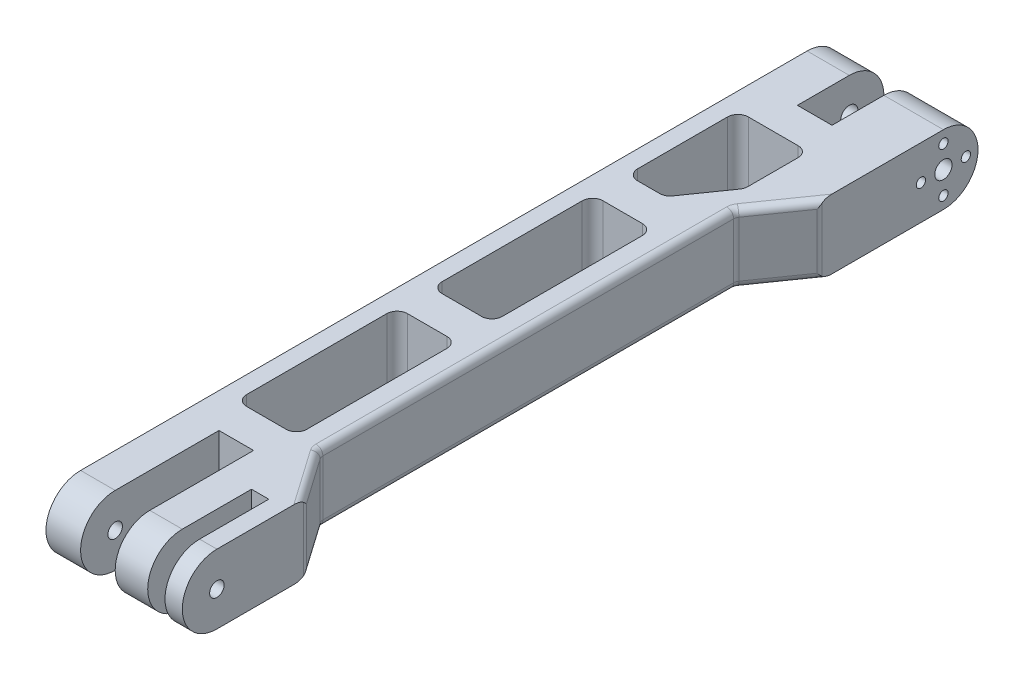
from build123d import *

# Parameters (mm, degrees)
SKETCH_1_W          = 39.4
SKETCH_1_H          = 20
EXTRUDE_1_DEPTH     = 230
FILLET_2_RADIUS     = 10
FILLET_2_LENGTH     = 39.4
SKETCH_2_R          = 2.5
CUT_EXTRUDE_1_DEPTH = 235.205806931
SKETCH_3_W          = 10
SKETCH_3_H          = 25
CUT_EXTRUDE_2_DEPTH = 235.205806931
SKETCH_4_R          = 1.35
CUT_EXTRUDE_3_DEPTH = 20
CUT_EXTRUDE_4_DEPTH = 235.205806931
FILLET_4_R          = 2
FILLET_5_RADIUS     = 10
FILLET_5_LENGTH     = 39.4
SKETCH_6_R          = 2.1
CUT_EXTRUDE_5_DEPTH = 235.205806931
SKETCH_7_W          = 10
SKETCH_7_H          = 40
CUT_EXTRUDE_6_DEPTH = 235.205806931
CUT_EXTRUDE_7_DEPTH = 235.205806931
SKETCH_9_W          = 5
SKETCH_9_H          = 30
CUT_EXTRUDE_8_DEPTH = 235.205806931


with BuildPart() as part:
    # 草图1 → 凸台-拉伸1 (new body)
    with BuildSketch(Plane.XY):
        with Locations((19.7, 10)):
            Rectangle(SKETCH_1_W, SKETCH_1_H)
    extrude(amount=EXTRUDE_1_DEPTH)

    # 圆角2: full round fillet: the end face becomes a half cylinder, R = half its width
    fillet_2_face = Plane((19.7, 10, 0), x_dir=(1, 0, 0), z_dir=(0, 0, -1))  # on the end face: x along it, z out of the body
    fillet_2_slab = fillet_2_face.offset(-FILLET_2_RADIUS / 2) * Box(FILLET_2_LENGTH, 2 * FILLET_2_RADIUS, FILLET_2_RADIUS, mode=Mode.PRIVATE)  # the body's end, R deep
    fillet_2_round = Plane((19.7, 10, 10), x_dir=(0, 0, -1), z_dir=(1, 0, 0)) * Cylinder(FILLET_2_RADIUS, FILLET_2_LENGTH, mode=Mode.PRIVATE)  # its axis R under the face
    add(fillet_2_slab - fillet_2_round, mode=Mode.SUBTRACT)

    # 草图2 → 切除-拉伸1 (cut, through all)
    with BuildSketch(Plane.ZY):
        with Locations((10, 10)):
            Circle(SKETCH_2_R)
    extrude(amount=-CUT_EXTRUDE_1_DEPTH, mode=Mode.SUBTRACT)

    # 草图3 → 切除-拉伸2 (cut, through all)
    with BuildSketch(Plane(origin=(0, 0, 0), x_dir=(-1, 0, 0), z_dir=(0, -1, 0))):
        with Locations((-17.2, -12.5)):
            Rectangle(SKETCH_3_W, SKETCH_3_H)
    extrude(amount=-CUT_EXTRUDE_2_DEPTH, mode=Mode.SUBTRACT)

    # 草图4 → 切除-拉伸3 (cut)
    with BuildSketch(Plane(origin=(39.4, 0, 0), x_dir=(0, 0, -1), z_dir=(1, 0, 0))):
        with Locations((-3.5, 10)):
            Circle(SKETCH_4_R)
        with Locations((-10, 16.5)):
            Circle(SKETCH_4_R)
        with Locations((-16.5, 10)):
            Circle(SKETCH_4_R)
        with Locations((-10, 3.5)):
            Circle(SKETCH_4_R)
    extrude(amount=-CUT_EXTRUDE_3_DEPTH, mode=Mode.SUBTRACT)

    # 草图5 → 切除-拉伸4 (cut, through all)
    with BuildSketch(Plane(origin=(0, 0, 0), x_dir=(-1, 0, 0), z_dir=(0, -1, 0))):
        Polygon((-39.4, -45.718519933), (-29.4, -60), (-29.4, -180), (-39.4, -194.281480067), align=None)
    extrude(amount=-CUT_EXTRUDE_4_DEPTH, mode=Mode.SUBTRACT)

    # 圆角4
    fillet_4_edges = [part.edges().sort_by_distance(p)[0] for p in [
        (39.4, 10, 194.281480067),
        (34.4, 20, 52.859259966),
        (39.4, 10, 45.718519933),
        (29.4, 20, 120),
        (29.4, 10, 60),
        (34.4, 20, 187.140740034),
        (29.4, 10, 180),
        (34.4, 0, 187.140740034),
        (29.4, 0, 120),
        (34.4, 0, 52.859259966),
    ]]
    fillet(fillet_4_edges, radius=FILLET_4_R)

    # 圆角5: full round fillet: the end face becomes a half cylinder, R = half its width
    fillet_5_face = Plane((19.7, 10, 230), x_dir=(-1, 0, 0), z_dir=(0, 0, 1))  # on the end face: x along it, z out of the body
    fillet_5_slab = fillet_5_face.offset(-FILLET_5_RADIUS / 2) * Box(FILLET_5_LENGTH, 2 * FILLET_5_RADIUS, FILLET_5_RADIUS, mode=Mode.PRIVATE)  # the body's end, R deep
    fillet_5_round = Plane((19.7, 10, 220), x_dir=(0, 0, 1), z_dir=(-1, 0, 0)) * Cylinder(FILLET_5_RADIUS, FILLET_5_LENGTH, mode=Mode.PRIVATE)  # its axis R under the face
    add(fillet_5_slab - fillet_5_round, mode=Mode.SUBTRACT)

    # 草图6 → 切除-拉伸5 (cut, through all)
    with BuildSketch(Plane.ZY):
        with Locations((220, 10)):
            Circle(SKETCH_6_R)
    extrude(amount=-CUT_EXTRUDE_5_DEPTH, mode=Mode.SUBTRACT)

    # 草图7 → 切除-拉伸6 (cut, through all)
    with BuildSketch(Plane(origin=(0, 0, 0), x_dir=(-1, 0, 0), z_dir=(0, -1, 0))):
        with Locations((-15, -210)):
            Rectangle(SKETCH_7_W, SKETCH_7_H)
    extrude(amount=-CUT_EXTRUDE_6_DEPTH, mode=Mode.SUBTRACT)

    # 草图8 → 切除-拉伸7 (cut, through all)
    with BuildSketch(Plane(origin=(0, 0, 0), x_dir=(-1, 0, 0), z_dir=(0, -1, 0))):
        with BuildLine():
            Line((-5, -64), (-5, -38))
            ThreePointArc((-5, -38), (-5.878679656, -35.878679656), (-8, -35))
            Line((-8, -35), (-22.4, -35))
            ThreePointArc((-22.4, -35), (-24.521320344, -35.878679656), (-25.4, -38))
            Line((-25.4, -38), (-25.4, -52.562568091))
            ThreePointArc((-25.4, -52.562568091), (-25.261150852, -53.464685489), (-24.857456133, -54.2832974))
            Line((-24.857456133, -54.2832974), (-16.848880092, -65.720729309))
            ThreePointArc((-16.848880092, -65.720729309), (-15.776669799, -66.6610325), (-14.39142396, -67))
            Line((-14.39142396, -67), (-8, -67))
            ThreePointArc((-8, -67), (-5.878679656, -66.121320344), (-5, -64))
        make_face()
        with BuildLine():
            Line((-8, -77), (-19.4, -77))
            ThreePointArc((-19.4, -77), (-21.521320344, -77.878679656), (-22.4, -80))
            Line((-22.4, -80), (-22.4, -120.5))
            ThreePointArc((-22.4, -120.5), (-21.521320344, -122.621320344), (-19.4, -123.5))
            Line((-19.4, -123.5), (-8, -123.5))
            ThreePointArc((-8, -123.5), (-5.878679656, -122.621320344), (-5, -120.5))
            Line((-5, -120.5), (-5, -80))
            ThreePointArc((-5, -80), (-5.878679656, -77.878679656), (-8, -77))
        make_face()
        with BuildLine():
            Line((-8, -133.5), (-19.4, -133.5))
            ThreePointArc((-19.4, -133.5), (-21.521320344, -134.378679656), (-22.4, -136.5))
            Line((-22.4, -136.5), (-22.4, -177))
            ThreePointArc((-22.4, -177), (-21.521320344, -179.121320344), (-19.4, -180))
            Line((-19.4, -180), (-8, -180))
            ThreePointArc((-8, -180), (-5.878679656, -179.121320344), (-5, -177))
            Line((-5, -177), (-5, -136.5))
            ThreePointArc((-5, -136.5), (-5.878679656, -134.378679656), (-8, -133.5))
        make_face()
    extrude(amount=-CUT_EXTRUDE_7_DEPTH, mode=Mode.SUBTRACT)

    # 草图9 → 切除-拉伸8 (cut, through all)
    with BuildSketch(Plane(origin=(0, 0, 0), x_dir=(-1, 0, 0), z_dir=(0, -1, 0))):
        with Locations((-31.9, -215)):
            Rectangle(SKETCH_9_W, SKETCH_9_H)
    extrude(amount=-CUT_EXTRUDE_8_DEPTH, mode=Mode.SUBTRACT)


solid = part.part
